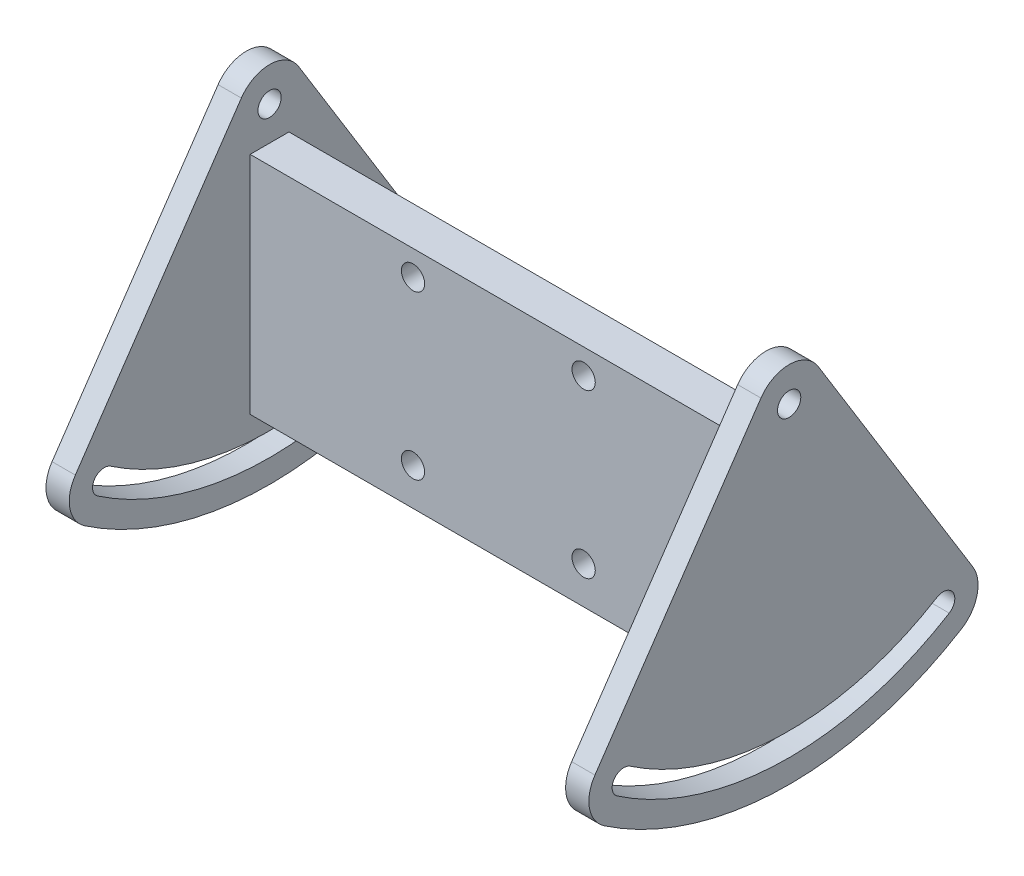
from build123d import *

# Parameters (mm, degrees)
SKETCH_1_R               = 1.5
EXTRUDE_1_DEPTH          = 70
CUT_EXTRUDE_1_DEPTH      = 40
CUT_EXTRUDE_1_DEPTH_BACK = 48
SKETCH_3_W               = 64
SKETCH_3_H               = 30
SKETCH_4_R               = 1.5
CUT_EXTRUDE_2_DEPTH      = 10
CUT_EXTRUDE_4_DEPTH      = 17
CUT_EXTRUDE_4_DEPTH_BACK = 11
SKETCH_5_W               = 64
SKETCH_5_H               = 10
SKETCH_5_H_2             = 13


with BuildPart() as part:
    # 草图1 → 凸台-拉伸1 (new body)
    with BuildSketch(Plane(origin=(0, 0, 0), x_dir=(0, 0, -1), z_dir=(1, 0, 0))):
        with BuildLine():
            ThreePointArc((3.748616704, 13.830886654), (0.101280137, 15.922634297), (-3.638391548, 14.000830996))
            Line((-3.638391548, 14.000830996), (-25.044186814, -17.396344398))
            ThreePointArc((-25.044186814, -17.396344398), (-25.746563923, -20.773505291), (-23.851546095, -23.655771194))
            ThreePointArc((-23.851546095, -23.655771194), (-0.977489629, -30.968489282), (22.208659079, -24.715424983))
            ThreePointArc((22.208659079, -24.715424983), (24.234219774, -21.923355289), (23.687892423, -18.517466898))
            Line((23.687892423, -18.517466898), (3.748616704, 13.830886654))
        make_face()
        with BuildLine():
            ThreePointArc((20.640989027, -22.157611345), (-0.908490361, -27.96928287), (-22.167907547, -21.172756648))
            ThreePointArc((-22.167907547, -21.172756648), (-22.567595547, -19.0894301), (-20.484268999, -18.689742101))
            ThreePointArc((-20.484268999, -18.689742101), (-0.839491093, -24.970076458), (19.073318974, -19.599797708))
            ThreePointArc((19.073318974, -19.599797708), (21.136060819, -20.0948695), (20.640989027, -22.157611345))
        make_face(mode=Mode.SUBTRACT)
        with Locations((0, 11.52026822)):
            Circle(SKETCH_1_R, mode=Mode.SUBTRACT)
    extrude(amount=EXTRUDE_1_DEPTH)

    # 草图3 → 切除-拉伸1 (cut, two sides: drawn at the far end of the back side and taken through both)
    with BuildSketch(Plane(origin=(0, 0, 0), x_dir=(1, 0, 0), z_dir=(0, 1, 0)).offset(-CUT_EXTRUDE_1_DEPTH_BACK)):
        with Locations((35, 17.5)):
            Rectangle(SKETCH_3_W, SKETCH_3_H)
        with Locations((35, -17.5)):
            Rectangle(SKETCH_3_W, SKETCH_3_H)
    extrude(amount=CUT_EXTRUDE_1_DEPTH + CUT_EXTRUDE_1_DEPTH_BACK, mode=Mode.SUBTRACT)

    # 草图4 → 切除-拉伸2 (cut)
    with BuildSketch(Plane.XY.offset(2.5)):
        with Locations((24, 3.92379916)):
            Circle(SKETCH_4_R)
        with Locations((46, 3.92379916)):
            Circle(SKETCH_4_R)
        with Locations((46, -17.07620084)):
            Circle(SKETCH_4_R)
        with Locations((24, -17.07620084)):
            Circle(SKETCH_4_R)
    extrude(amount=-CUT_EXTRUDE_2_DEPTH, mode=Mode.SUBTRACT)

    # 草图5 → 切除-拉伸4 (cut, two sides: drawn at the far end of the back side and taken through both)
    with BuildSketch(Plane.XY.offset(2.5).offset(-CUT_EXTRUDE_4_DEPTH_BACK)):
        with Locations((35, -26.894014692)):
            Rectangle(SKETCH_5_W, SKETCH_5_H)
        with Locations((35, 13.645331632)):
            Rectangle(SKETCH_5_W, SKETCH_5_H_2)
    extrude(amount=CUT_EXTRUDE_4_DEPTH + CUT_EXTRUDE_4_DEPTH_BACK, mode=Mode.SUBTRACT)


solid = part.part
